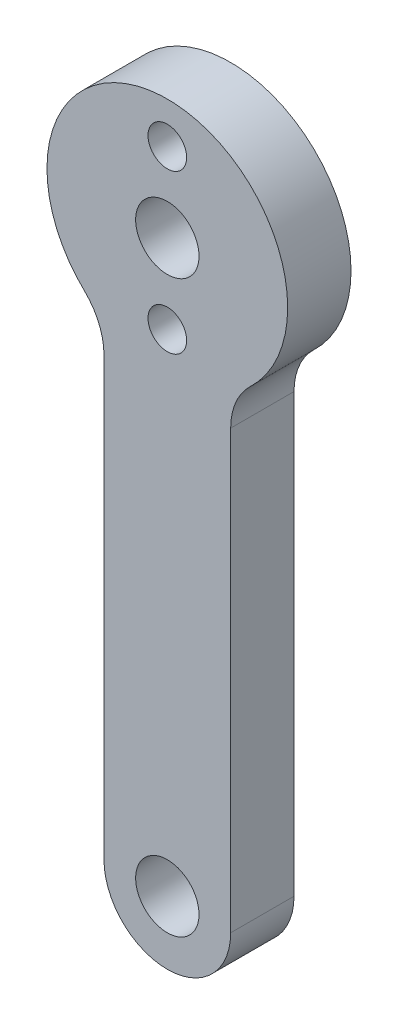
from build123d import *

# Parameters (mm, degrees)
EXTRUDE_1_DEPTH     = 5
SKETCH_3_R          = 2.5
CUT_EXTRUDE_1_DEPTH = 24
SKETCH_4_R          = 1.525
CUT_EXTRUDE_2_DEPTH = 5
SKETCH_5_R          = 2.5
CUT_EXTRUDE_3_DEPTH = 5
FILLET_1_R          = 5


with BuildPart() as part:
    # 草图1 → 凸台-拉伸1 (new body)
    with BuildSketch(Plane.XY):
        with BuildLine():
            Line((5, -8.077747211), (5, -45))
            ThreePointArc((5, -45), (0, -50), (-5, -45))
            Line((-5, -45), (-5, -8.077747211))
            ThreePointArc((-5, -8.077747211), (0, 9.5), (5, -8.077747211))
        make_face()
    extrude(amount=EXTRUDE_1_DEPTH)

    # 草图3 → 切除-拉伸1 (cut)
    with BuildSketch(Plane.XY.offset(5)):
        with Locations((0, -45)):
            Circle(SKETCH_3_R)
    extrude(amount=-CUT_EXTRUDE_1_DEPTH, mode=Mode.SUBTRACT)

    # 草图4 → 切除-拉伸2 (cut)
    with BuildSketch(Plane.XY.offset(5)):
        with Locations((0, 6.25)):
            Circle(SKETCH_4_R)
        with Locations((0, -6.25)):
            Circle(SKETCH_4_R)
    extrude(amount=-CUT_EXTRUDE_2_DEPTH, mode=Mode.SUBTRACT)

    # 草图5 → 切除-拉伸3 (cut)
    with BuildSketch(Plane.XY.offset(5)):
        Circle(SKETCH_5_R)
    extrude(amount=-CUT_EXTRUDE_3_DEPTH, mode=Mode.SUBTRACT)

    # 圆角1
    fillet_1_edges = [part.edges().sort_by_distance(p)[0] for p in [
        (-5, -8.077747211, 2.5),
        (5, -8.077747211, 2.5),
    ]]
    fillet(fillet_1_edges, radius=FILLET_1_R)


solid = part.part
